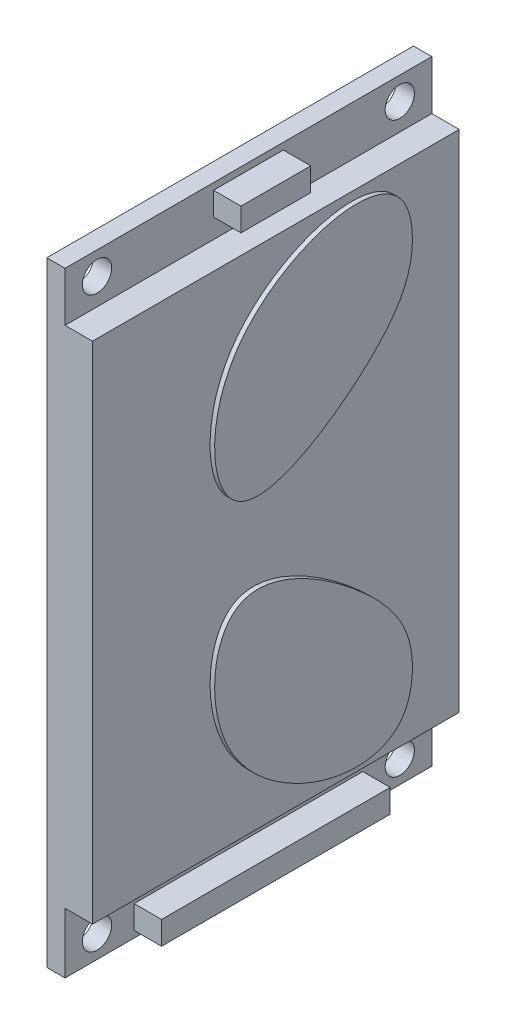
from build123d import *

# Parameters (mm, degrees)
SKETCH1_W           = 40.1
SKETCH1_H           = 67.2
SKETCH1_R           = 1.6
BOSS_EXTRUDE1_DEPTH = 2
SKETCH2_W           = 40.1
SKETCH2_H           = 55.2
SKETCH2_W_2         = 25
SKETCH2_H_2         = 2.54
SKETCH2_W_3         = 7.62
BOSS_EXTRUDE2_DEPTH = 3
BOSS_EXTRUDE3_DEPTH = 0.5


with BuildPart() as part:
    # Sketch1 → Boss-Extrude1 (new body)
    with BuildSketch(Plane(origin=(0, 0, 0), x_dir=(0, 0, -1), z_dir=(1, 0, 0))):
        Rectangle(SKETCH1_W, SKETCH1_H)
        with Locations((16.55, 31.1)):
            Circle(SKETCH1_R, mode=Mode.SUBTRACT)
        with Locations((16.55, -31.11)):
            Circle(SKETCH1_R, mode=Mode.SUBTRACT)
        with Locations(Location((-16.55, -31.11, 0), (0, 0, 180))):
            Circle(SKETCH1_R, mode=Mode.SUBTRACT)
        with Locations(Location((-16.55, 31.1, 0), (0, 0, 180))):
            Circle(SKETCH1_R, mode=Mode.SUBTRACT)
    extrude(amount=BOSS_EXTRUDE1_DEPTH)

    # Sketch2 → Boss-Extrude2 (add)
    with BuildSketch(Plane(origin=(2, 0, 0), x_dir=(0, 0, -1), z_dir=(1, 0, 0))):
        with Locations((0, 0.6)):
            Rectangle(SKETCH2_W, SKETCH2_H)
        with Locations((0, -31.6)):
            Rectangle(SKETCH2_W_2, SKETCH2_H_2)
        with Locations((0, 31.6)):
            Rectangle(SKETCH2_W_3, SKETCH2_H_2)
    extrude(amount=BOSS_EXTRUDE2_DEPTH)

    # Sketch3 → Boss-Extrude3 (add)
    with BuildSketch(Plane(origin=(5, 0, 0), x_dir=(0, 0, -1), z_dir=(1, 0, 0))):
        with BuildLine():
            add(Edge.make_bspline(
                [(9.428160808, -10.258647158), (12.148533605, -12.766508078), (15.01174655, -16.60061625), (13.414973779, -29.671171948), (-8.894779227, -22.798689467), (-7.128189514, 1.292467688), (5.124002127, -6.290723583), (9.428160808, -10.258647158)],
                knots=[0, 0, 0, 0, 0.152454057, 0.233716346, 0.541000039, 0.75878804, 1, 1, 1, 1], degree=3))
        make_face()
        with BuildLine():
            add(Edge.make_bspline(
                [(9.428160808, 11.458647158), (12.148533605, 13.966508078), (15.01174655, 17.80061625), (13.414973779, 30.871171948), (-8.894779227, 23.998689467), (-7.128189514, -0.092467688), (5.124002127, 7.490723583), (9.428160808, 11.458647158)],
                knots=[0, 0, 0, 0, 0.152454057, 0.233716346, 0.541000039, 0.75878804, 1, 1, 1, 1], degree=3))
        make_face()
    extrude(amount=BOSS_EXTRUDE3_DEPTH)


solid = part.part
